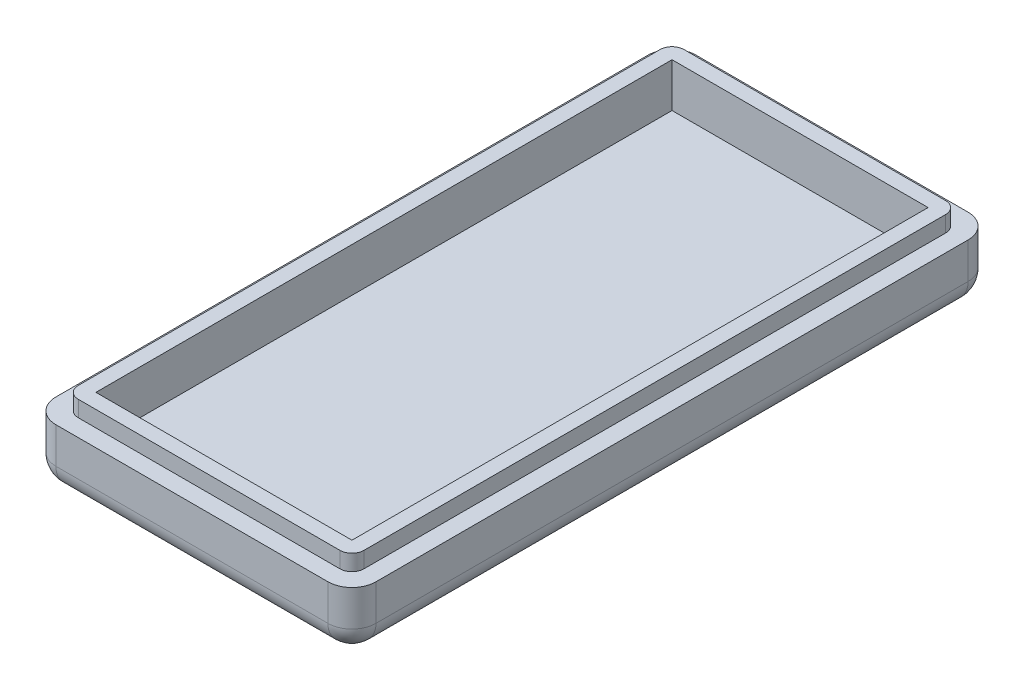
from build123d import *

# Parameters (mm, degrees)
SKETCH1_W           = 40
SKETCH1_H           = 7.5
BOSS_EXTRUDE1_DEPTH = 80
SHELL1_T            = -4
FILLET1_R           = 3
SKETCH2_W           = 32
SKETCH2_H           = 72
BOSS_EXTRUDE2_DEPTH = 2


with BuildPart() as part:
    # Sketch1 → Boss-Extrude1 (new body)
    with BuildSketch(Plane.XY):
        with Locations((20, 3.75)):
            Rectangle(SKETCH1_W, SKETCH1_H)
    extrude(amount=BOSS_EXTRUDE1_DEPTH)

    # Shell1
    shell1_openings = [part.faces().sort_by_distance(p)[0] for p in [
        (20, 7.5, 40),
    ]]
    offset(amount=SHELL1_T, openings=shell1_openings, kind=Kind.INTERSECTION)

    # Fillet1
    fillet1_edges = [part.edges().sort_by_distance(p)[0] for p in [
        (40, 3.75, 80),
        (0, 3.75, 80),
        (40, 3.75, 0),
        (20, 0, 0),
        (0, 3.75, 0),
        (40, 0, 40),
        (0, 0, 40),
        (20, 0, 80),
    ]]
    fillet(fillet1_edges, radius=FILLET1_R)

    # Sketch2 → Boss-Extrude2 (add)
    with BuildSketch(Plane(origin=(0, 7.5, 0), x_dir=(1, 0, 0), z_dir=(0, 1, 0))):
        with BuildLine():
            Line((3.65, -77.85), (36.35, -77.85))
            ThreePointArc((36.35, -77.85), (37.410660172, -77.410660172), (37.85, -76.35))
            Line((37.85, -76.35), (37.85, -3.65))
            ThreePointArc((37.85, -3.65), (37.410660172, -2.589339828), (36.35, -2.15))
            Line((36.35, -2.15), (3.65, -2.15))
            ThreePointArc((3.65, -2.15), (2.589339828, -2.589339828), (2.15, -3.65))
            Line((2.15, -3.65), (2.15, -76.35))
            ThreePointArc((2.15, -76.35), (2.589339828, -77.410660172), (3.65, -77.85))
        make_face()
        with Locations((20, -40)):
            Rectangle(SKETCH2_W, SKETCH2_H, mode=Mode.SUBTRACT)
    extrude(amount=BOSS_EXTRUDE2_DEPTH)


solid = part.part
